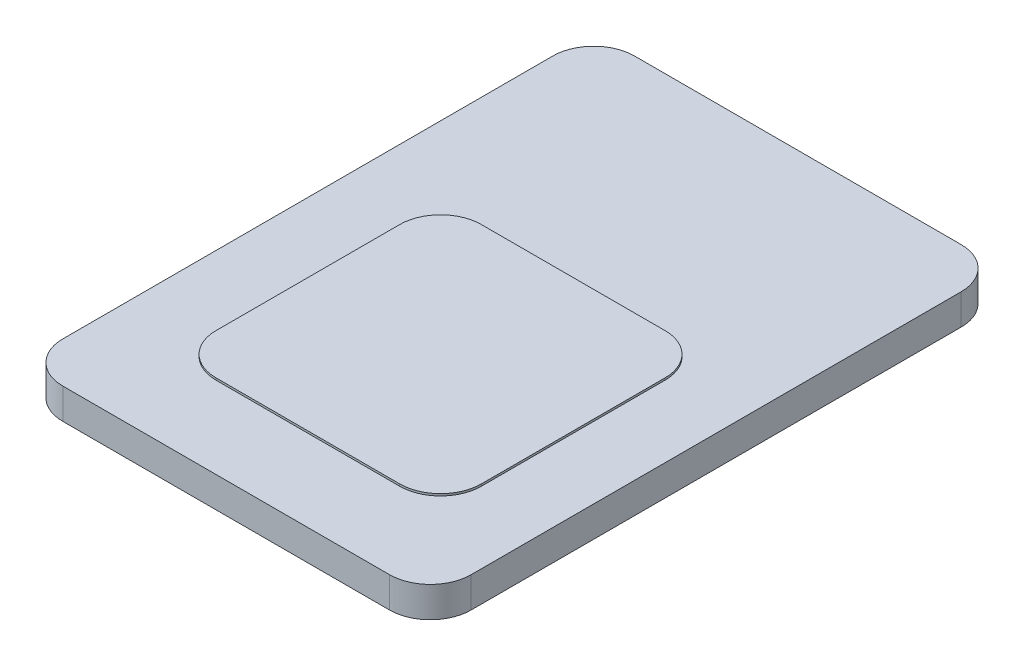
from build123d import *

# Parameters (mm, degrees)
SKETCH1_W           = 20
SKETCH1_H           = 28
BOSS_EXTRUDE1_DEPTH = 1.5
BOSS_EXTRUDE2_DEPTH = 0.1
FILLET1_R           = 2


with BuildPart() as part:
    # Sketch1 → Boss-Extrude1 (new body)
    with BuildSketch(Plane(origin=(0, 0, 0), x_dir=(1, 0, 0), z_dir=(0, 1, 0))):
        with Locations((10, 14)):
            Rectangle(SKETCH1_W, SKETCH1_H)
    extrude(amount=BOSS_EXTRUDE1_DEPTH)

    # Sketch2 → Boss-Extrude2 (add)
    with BuildSketch(Plane(origin=(0, 1.5, 0), x_dir=(1, 0, 0), z_dir=(0, 1, 0))):
        with BuildLine():
            Line((5.5, 17), (14.5, 17))
            ThreePointArc((14.5, 17), (15.914213562, 16.414213562), (16.5, 15))
            Line((16.5, 15), (16.5, 6))
            ThreePointArc((16.5, 6), (15.914213562, 4.585786438), (14.5, 4))
            Line((14.5, 4), (5.5, 4))
            ThreePointArc((5.5, 4), (4.085786438, 4.585786438), (3.5, 6))
            Line((3.5, 6), (3.5, 15))
            ThreePointArc((3.5, 15), (4.085786438, 16.414213562), (5.5, 17))
        make_face()
    extrude(amount=BOSS_EXTRUDE2_DEPTH)

    # Fillet1
    fillet1_edges = [part.edges().sort_by_distance(p)[0] for p in [
        (0, 0.75, -28),
        (20, 0.75, -28),
        (20, 0.75, 0),
        (0, 0.75, 0),
    ]]
    fillet(fillet1_edges, radius=FILLET1_R)


solid = part.part
